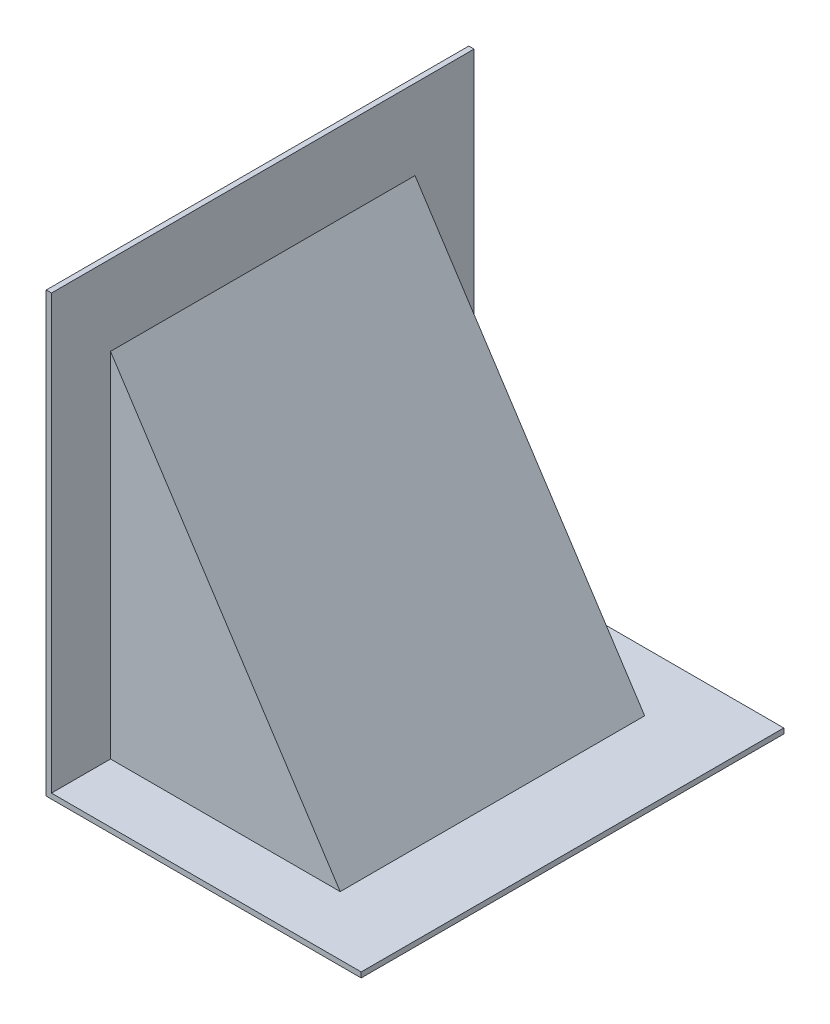
from build123d import *

# Parameters (mm, degrees)
BOSS_EXTRUDE1_DEPTH = 116
SKETCH2_W           = 118
SKETCH2_H           = 161
BOSS_EXTRUDE2_DEPTH = 2
SKETCH3_W           = 161
SKETCH3_H           = 167
BOSS_EXTRUDE4_DEPTH = 2


with BuildPart() as part:
    # Sketch1 → Boss-Extrude1 (new body)
    with BuildSketch(Plane.XY):
        Polygon((0, 0), (87.5, 0), (0, 134.5), align=None)
    extrude(amount=BOSS_EXTRUDE1_DEPTH)

    # Sketch2 → Boss-Extrude2 (add)
    with BuildSketch(Plane(origin=(0, 0, 0), x_dir=(-1, 0, 0), z_dir=(0, -1, 0))):
        with Locations((-59, -58)):
            Rectangle(SKETCH2_W, SKETCH2_H)
    extrude(amount=BOSS_EXTRUDE2_DEPTH)

    # Sketch3 → Boss-Extrude4 (add)
    with BuildSketch(Plane.ZY):
        with Locations((58, 81.5)):
            Rectangle(SKETCH3_W, SKETCH3_H)
    extrude(amount=BOSS_EXTRUDE4_DEPTH)


solid = part.part
